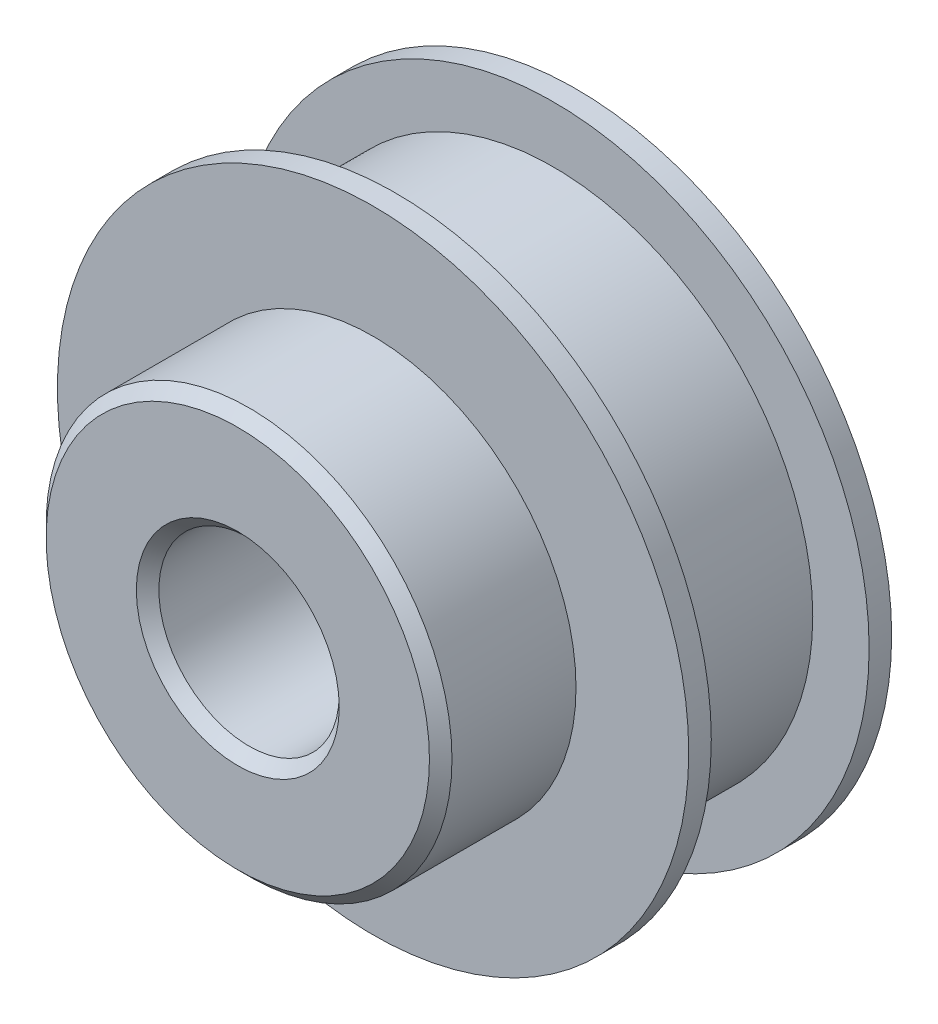
from build123d import *

# Parameters (mm, degrees)
SKETCH1_R           = 14
BOSS_EXTRUDE1_DEPTH = 1
SKETCH2_R           = 11.5
BOSS_EXTRUDE2_DEPTH = 7
SKETCH3_R           = 14
BOSS_EXTRUDE3_DEPTH = 1
SKETCH4_R           = 9
BOSS_EXTRUDE4_DEPTH = 6
SKETCH5_R           = 4
CUT_EXTRUDE1_DEPTH  = 23
CHAMFER1_SIZE       = 0.5


with BuildPart() as part:
    # Sketch1 → Boss-Extrude1 (new body)
    with BuildSketch(Plane.XY):
        Circle(SKETCH1_R)
    extrude(amount=BOSS_EXTRUDE1_DEPTH)

    # Sketch2 → Boss-Extrude2 (add)
    with BuildSketch(Plane.XY.offset(1)):
        Circle(SKETCH2_R)
    extrude(amount=BOSS_EXTRUDE2_DEPTH)

    # Sketch3 → Boss-Extrude3 (add)
    with BuildSketch(Plane.XY.offset(8)):
        Circle(SKETCH3_R)
    extrude(amount=BOSS_EXTRUDE3_DEPTH)

    # Sketch4 → Boss-Extrude4 (add)
    with BuildSketch(Plane.XY.offset(9)):
        Circle(SKETCH4_R)
    extrude(amount=BOSS_EXTRUDE4_DEPTH)

    # Sketch5 → Cut-Extrude1 (cut)
    with BuildSketch(Plane(origin=(0, 0, 0), x_dir=(-1, 0, 0), z_dir=(0, 0, -1))):
        Circle(SKETCH5_R)
    extrude(amount=-CUT_EXTRUDE1_DEPTH, mode=Mode.SUBTRACT)

    # Chamfer1
    chamfer1_edges = [part.edges().sort_by_distance(p)[0] for p in [
        (-9, 0, 15),
        (4, 0, 15),
        (4, 0, 0),
    ]]
    chamfer(chamfer1_edges, length=CHAMFER1_SIZE)


solid = part.part
